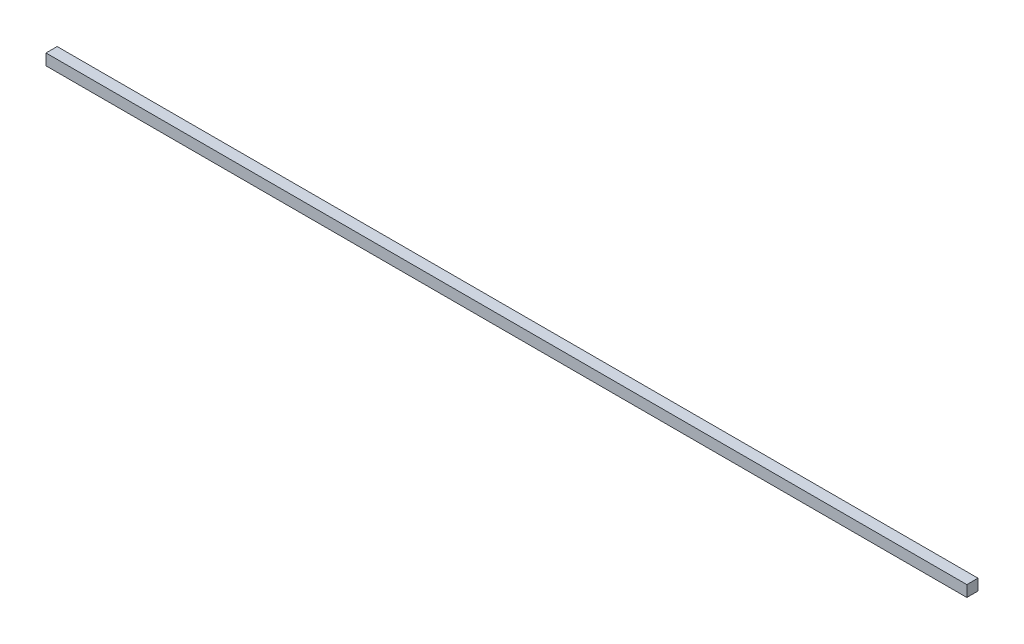
from build123d import *

# Parameters (mm, degrees)
TOPPING_KLAPE_ALT2_PIVOT_MIL_1_START = 22
SKETCH1_W                            = 660
SKETCH1_H                            = 8
TOPPING_KLAPE_ALT2_PIVOT_MIL_1_DEPTH = 8


with BuildPart() as part:
    # Sketch1 → TOPPING_klape_alt2_pivot_mil_1 (new body)
    with BuildSketch(Plane.XY.offset(TOPPING_KLAPE_ALT2_PIVOT_MIL_1_START)):
        with Locations((350, 206)):
            Rectangle(SKETCH1_W, SKETCH1_H)
    extrude(amount=TOPPING_KLAPE_ALT2_PIVOT_MIL_1_DEPTH)


solid = part.part
